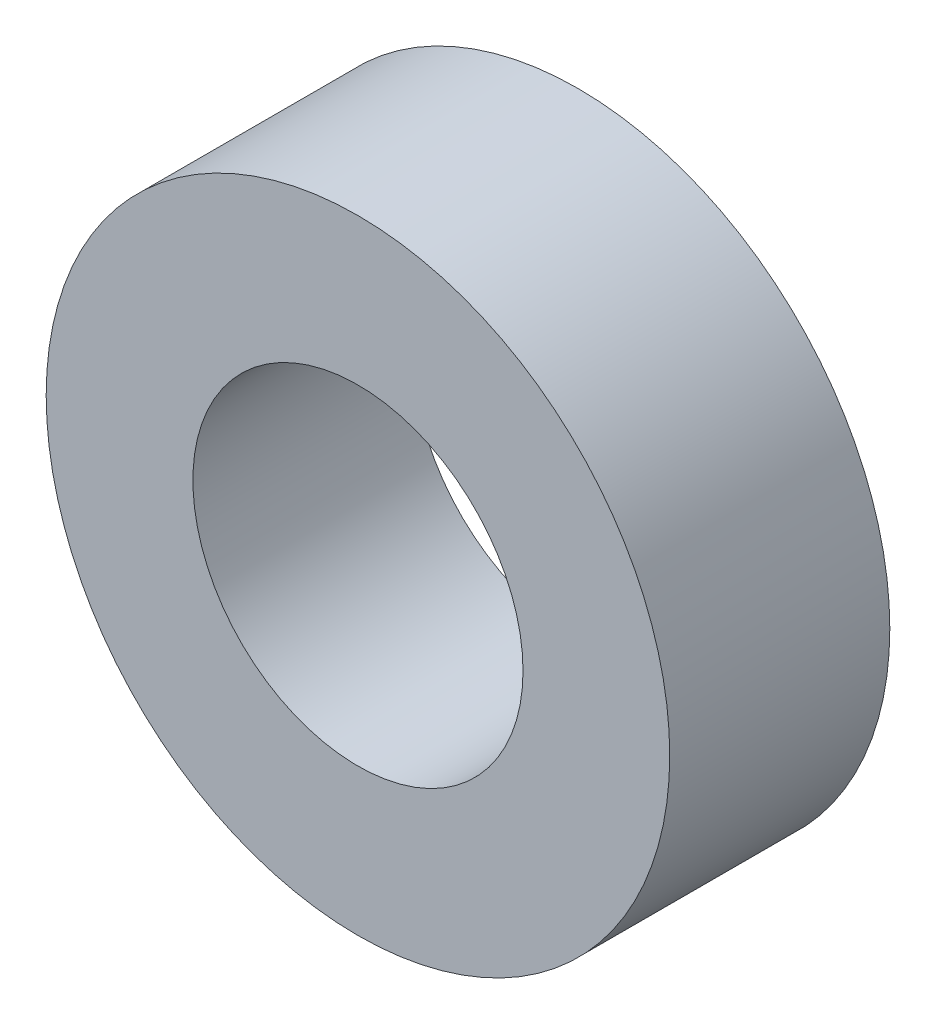
from build123d import *

# Parameters (mm, degrees)
ESQUISSE1_R        = 8.5
ESQUISSE1_R_2      = 4.5
BOSS_EXTRU_1_DEPTH = 6


with BuildPart() as part:
    # Esquisse1 → Boss.-Extru.1 (new body)
    with BuildSketch(Plane.XY):
        Circle(ESQUISSE1_R)
        Circle(ESQUISSE1_R_2, mode=Mode.SUBTRACT)
    extrude(amount=BOSS_EXTRU_1_DEPTH)


solid = part.part
